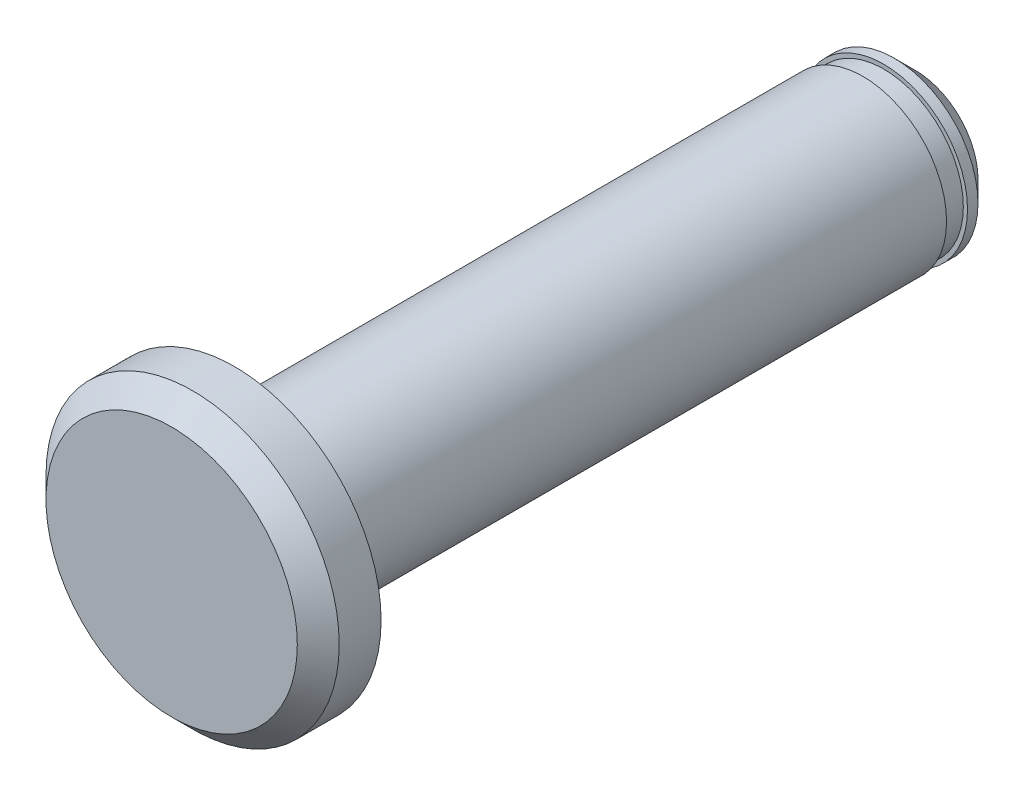
from build123d import *


with BuildPart() as part:
    # Esquisse2 → Base-Révolution (revolve)
    with BuildSketch(Plane(origin=(0, 0, 0), x_dir=(1, 0, 0), z_dir=(0, 1, 0)), mode=Mode.PRIVATE) as base_r_volution_sk:
        Polygon((-16.680780303, -30.626231876), (-16.680780303, -10.599160722), (-16.480780303, -10.599160722), (-16.480780303, -9.599160722), (-16.680780303, -9.599160722), (-16.680780303, -9.099160722), (-15.680780303, -8.099160722), (-12.680780303, -8.099160722), (-12.680780303, -43.599160722), (-18.680780303, -43.599160722), (-19.680780303, -42.599160722), (-19.680780303, -40.599160722), (-16.680780303, -40.599160722), align=None)
    revolve(base_r_volution_sk.sketch.rotate(Axis((-12.680780303, 0, 67.53791491), (0, 0, -1)), 180), axis=Axis((-12.680780303, 0, 67.53791491), (0, 0, -1)))


solid = part.part
